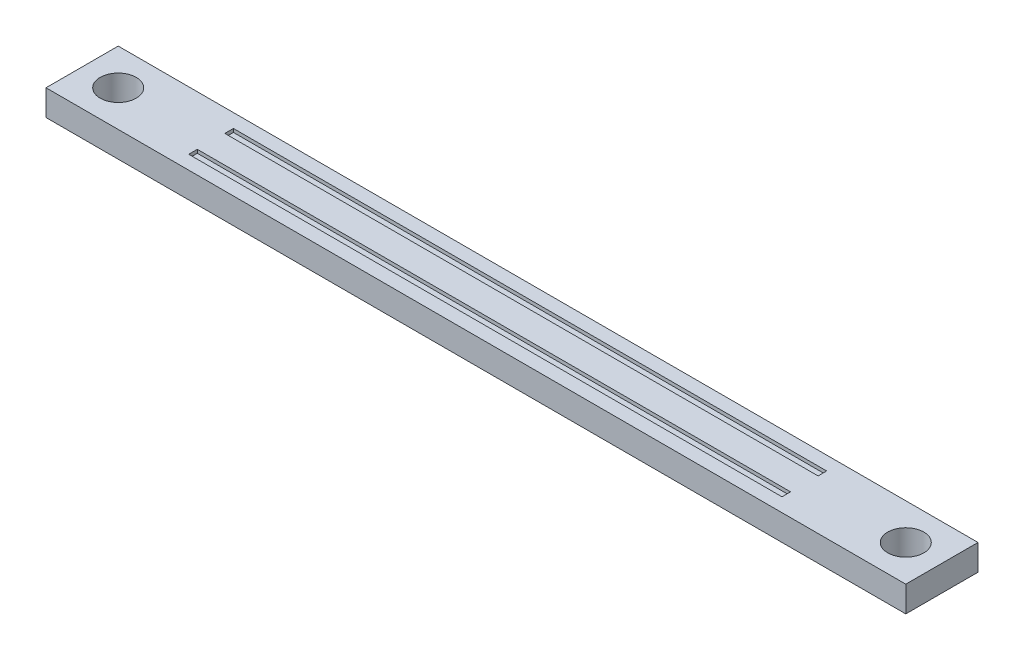
from build123d import *

# Parameters (mm, degrees)
ESQUISSE1_W             = 520
ESQUISSE1_H             = 42
BOSS_EXTRU_1_DEPTH      = 15
ESQUISSE2_R             = 10.5
ENL_V_MAT_EXTRU_1_DEPTH = 15
ESQUISSE3_W             = 10
ESQUISSE3_H             = 42
ENL_V_MAT_EXTRU_2_DEPTH = 262.277630118
ESQUISSE4_W             = 345
ESQUISSE4_H             = 5
ENL_V_MAT_EXTRU_3_DEPTH = 2


with BuildPart() as part:
    # Esquisse1 → Boss.-Extru.1 (new body)
    with BuildSketch(Plane(origin=(0, 0, 0), x_dir=(1, 0, 0), z_dir=(0, 1, 0))):
        Rectangle(ESQUISSE1_W, ESQUISSE1_H)
    extrude(amount=BOSS_EXTRU_1_DEPTH)

    # Esquisse2 → Enlèv. mat.-Extru.1 (cut)
    with BuildSketch(Plane(origin=(0, 15, 0), x_dir=(1, 0, 0), z_dir=(0, 1, 0))):
        with Locations(Location((-229, 0, 0), (0, 0, 270))):
            Circle(ESQUISSE2_R)
        with Locations(Location((229, 0, 0), (0, 0, 270))):
            Circle(ESQUISSE2_R)
    extrude(amount=-ENL_V_MAT_EXTRU_1_DEPTH, mode=Mode.SUBTRACT)

    # Esquisse3 → Enlèv. mat.-Extru.2 (cut, through all)
    with BuildSketch(Plane(origin=(0, 15, 0), x_dir=(1, 0, 0), z_dir=(0, 1, 0))):
        with Locations((-255, 0)):
            Rectangle(ESQUISSE3_W, ESQUISSE3_H)
        with Locations((255, 0)):
            Rectangle(ESQUISSE3_W, ESQUISSE3_H)
    extrude(amount=-ENL_V_MAT_EXTRU_2_DEPTH, mode=Mode.SUBTRACT)

    # Esquisse4 → Enlèv. mat.-Extru.3 (cut)
    with BuildSketch(Plane(origin=(0, 15, 0), x_dir=(1, 0, 0), z_dir=(0, 1, 0))):
        with Locations((-2.5, -10.5)):
            Rectangle(ESQUISSE4_W, ESQUISSE4_H)
        with Locations((-2.5, 10.5)):
            Rectangle(ESQUISSE4_W, ESQUISSE4_H)
    extrude(amount=-ENL_V_MAT_EXTRU_3_DEPTH, mode=Mode.SUBTRACT)


solid = part.part
